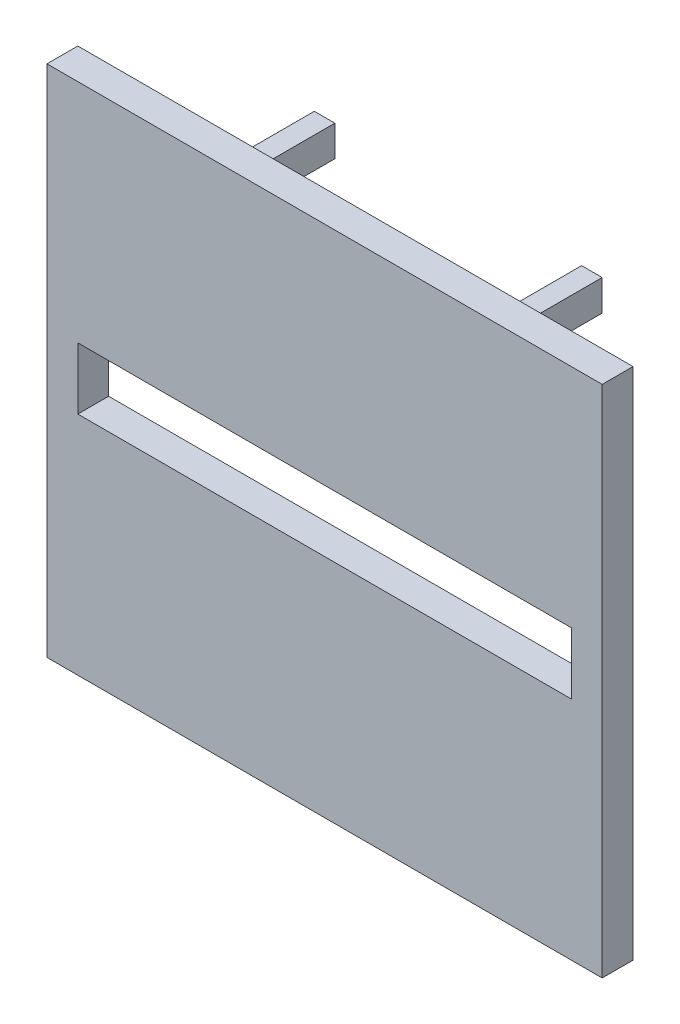
from build123d import *

# Parameters (mm, degrees)
SKETCH1_W           = 54
SKETCH1_H           = 50
SKETCH1_W_2         = 48
SKETCH1_H_2         = 6
BOSS_EXTRUDE1_DEPTH = 3
SKETCH2_W           = 2
SKETCH2_H           = 3
SKETCH2_W_2         = 1.834512626
SKETCH2_H_2         = 2.85876986
BOSS_EXTRUDE2_DEPTH = 10


with BuildPart() as part:
    # Sketch1 → Boss-Extrude1 (new body)
    with BuildSketch(Plane.XY):
        with Locations((27, 25)):
            Rectangle(SKETCH1_W, SKETCH1_H)
        with Locations((27, 25)):
            Rectangle(SKETCH1_W_2, SKETCH1_H_2, mode=Mode.SUBTRACT)
    extrude(amount=BOSS_EXTRUDE1_DEPTH)

    # Sketch2 → Boss-Extrude2 (add)
    with BuildSketch(Plane(origin=(0, 0, 0), x_dir=(-1, 0, 0), z_dir=(0, 0, -1))):
        with Locations((-40, 44.5)):
            Rectangle(SKETCH2_W, SKETCH2_H)
        with Locations((-14, 44.5)):
            Rectangle(SKETCH2_W, SKETCH2_H)
        with Locations((-40.082743687, 5.57061507)):
            Rectangle(SKETCH2_W_2, SKETCH2_H_2)
        with Locations((-14, 5.5)):
            Rectangle(SKETCH2_W, SKETCH2_H)
    extrude(amount=BOSS_EXTRUDE2_DEPTH)


solid = part.part
